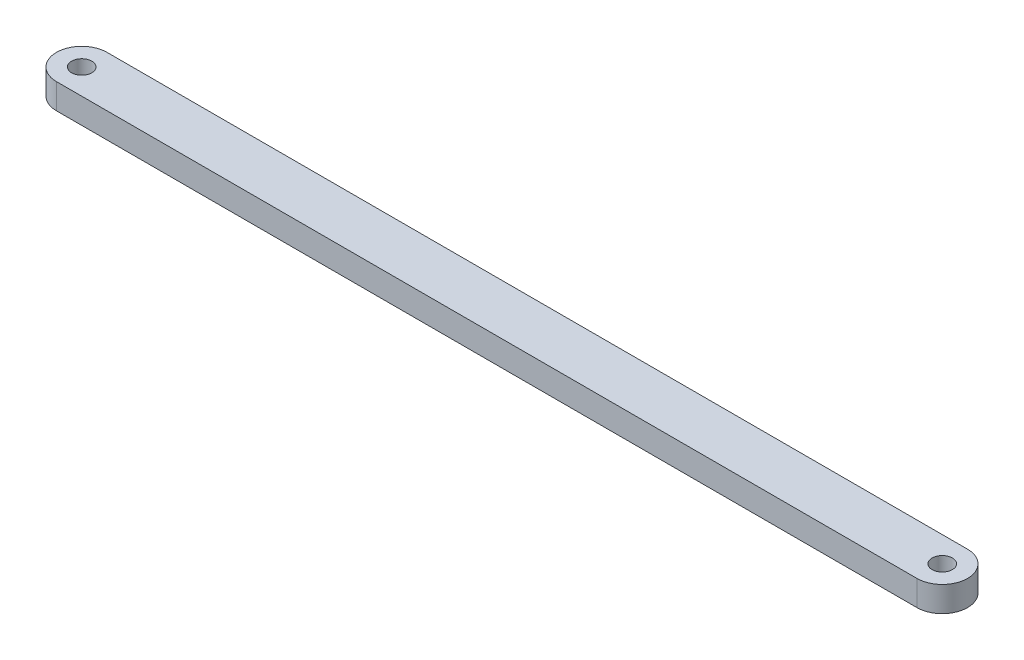
from build123d import *

# Parameters (mm, degrees)
EXTRUDE_1_DEPTH     = 5
SKETCH_2_R          = 2
CUT_EXTRUDE_1_DEPTH = 5


with BuildPart() as part:
    # 草图1 → 凸台-拉伸1 (new body)
    with BuildSketch(Plane(origin=(0, 0, 0), x_dir=(1, 0, 0), z_dir=(0, 1, 0))):
        with BuildLine():
            Line((0, 0), (-170, 0))
            ThreePointArc((-170, 0), (-175, 5), (-170, 10))
            Line((-170, 10), (0, 10))
            ThreePointArc((0, 10), (5, 5), (0, 0))
        make_face()
    extrude(amount=EXTRUDE_1_DEPTH)

    # 草图2 → 切除-拉伸1 (cut)
    with BuildSketch(Plane(origin=(0, 5, 0), x_dir=(1, 0, 0), z_dir=(0, 1, 0))):
        with Locations(Location((-170, 5, 0), (0, 0, 270))):
            Circle(SKETCH_2_R)
        with Locations(Location((0, 5, 0), (0, 0, 270))):
            Circle(SKETCH_2_R)
    extrude(amount=-CUT_EXTRUDE_1_DEPTH, mode=Mode.SUBTRACT)


solid = part.part
